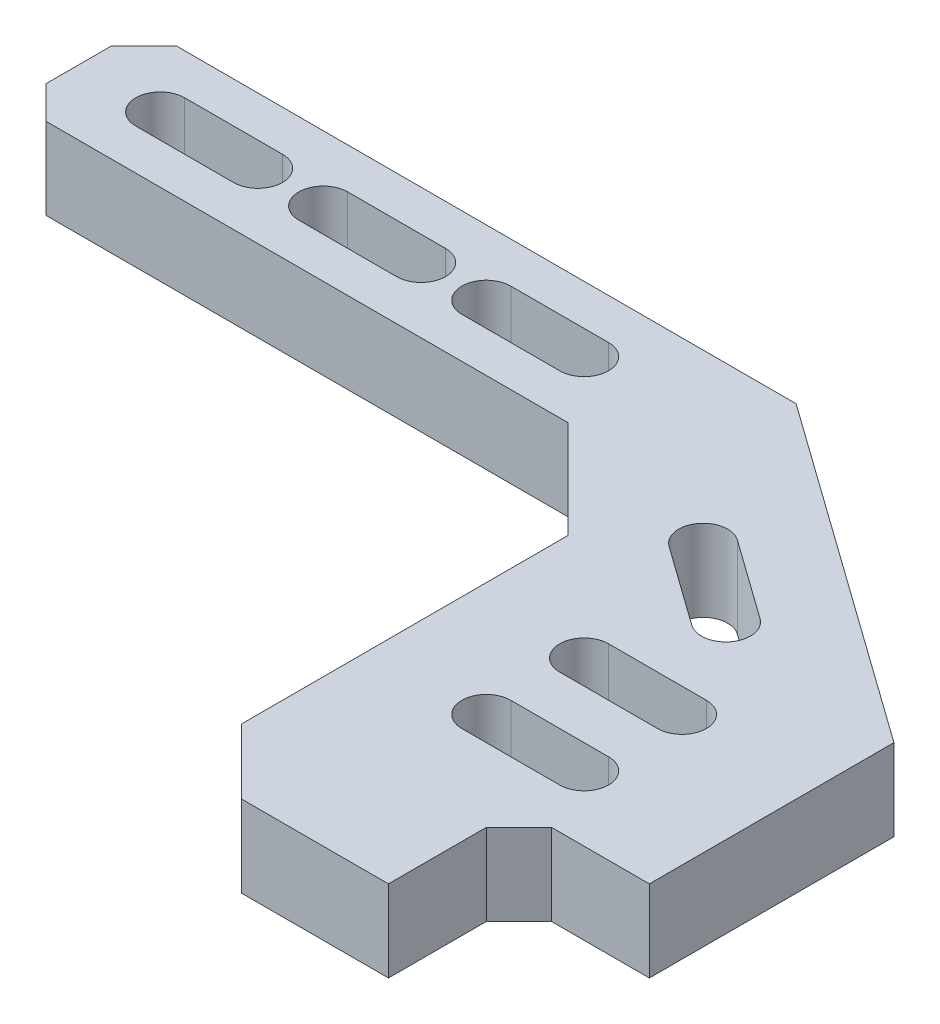
from build123d import *

# Parameters (mm, degrees)
EXTRUDE_1_DEPTH          = 5
CHAMFER_1_SIZE           = 6
CUT_EXTRUDE_1_DEPTH      = 54.4976635
CUT_EXTRUDE_1_DEPTH_BACK = 54.4976635
SKETCH_3_W               = 8
SKETCH_3_H               = 8
CHAMFER_2_SIZE           = 2
CHAMFER_3_SIZE           = 2
CHAMFER_4_SIZE           = 4


with BuildPart() as part:
    # 草图1 → 凸台-拉伸1 (new body)
    with BuildSketch(Plane(origin=(0, 0, 0), x_dir=(1, 0, 0), z_dir=(0, 1, 0))):
        Polygon((20, 4), (41, -11), (41, -34), (20, -34), (20, -4), (-20, -4), (-20, 4), align=None)
    extrude(amount=EXTRUDE_1_DEPTH)

    # 倒角1
    chamfer_1_edges = [part.edges().sort_by_distance(p)[0] for p in [
        (20, 2.5, 4),
    ]]
    chamfer(chamfer_1_edges, length=CHAMFER_1_SIZE)

    # 草图3 → 切除-拉伸1 (cut, two sides: drawn at the far end of the back side and taken through both)
    with BuildSketch(Plane(origin=(0, 5, 0), x_dir=(1, 0, 0), z_dir=(0, 1, 0)).offset(-CUT_EXTRUDE_1_DEPTH_BACK)):
        with BuildLine():
            Line((-15, 1.5), (-9, 1.5))
            ThreePointArc((-9, 1.5), (-7.5, 0), (-9, -1.5))
            Line((-9, -1.5), (-15, -1.5))
            ThreePointArc((-15, -1.5), (-16.5, 0), (-15, 1.5))
        make_face()
        with BuildLine():
            Line((-5, -1.5), (1, -1.5))
            ThreePointArc((1, -1.5), (2.5, 0), (1, 1.5))
            Line((1, 1.5), (-5, 1.5))
            ThreePointArc((-5, 1.5), (-6.5, 0), (-5, -1.5))
        make_face()
        with BuildLine():
            Line((5, -1.5), (11, -1.5))
            ThreePointArc((11, -1.5), (12.5, 0), (11, 1.5))
            Line((11, 1.5), (5, 1.5))
            ThreePointArc((5, 1.5), (3.5, 0), (5, -1.5))
        make_face()
        with BuildLine():
            Line((28.569343123, -10.964314788), (23.686942296, -7.476885626))
            ThreePointArc((23.686942296, -7.476885626), (23.33819938, -5.384428128), (25.430656877, -5.035685212))
            Line((25.430656877, -5.035685212), (30.313057704, -8.523114374))
            ThreePointArc((30.313057704, -8.523114374), (30.66180062, -10.615571872), (28.569343123, -10.964314788))
        make_face()
        with BuildLine():
            Line((27, -14.5), (33, -14.5))
            ThreePointArc((33, -14.5), (34.5, -16), (33, -17.5))
            Line((33, -17.5), (27, -17.5))
            ThreePointArc((27, -17.5), (25.5, -16), (27, -14.5))
        make_face()
        with Locations((37, -30)):
            Rectangle(SKETCH_3_W, SKETCH_3_H)
        with BuildLine():
            Line((27, -20.5), (33, -20.5))
            ThreePointArc((33, -20.5), (34.5, -22), (33, -23.5))
            Line((33, -23.5), (27, -23.5))
            ThreePointArc((27, -23.5), (25.5, -22), (27, -20.5))
        make_face()
    extrude(amount=CUT_EXTRUDE_1_DEPTH + CUT_EXTRUDE_1_DEPTH_BACK, mode=Mode.SUBTRACT)

    # 倒角2
    chamfer_2_edges = [part.edges().sort_by_distance(p)[0] for p in [
        (33, 2.5, 26),
    ]]
    chamfer(chamfer_2_edges, length=CHAMFER_2_SIZE)

    # 倒角3
    chamfer_3_edges = [part.edges().sort_by_distance(p)[0] for p in [
        (-20, 2.5, 4),
        (-20, 2.5, -4),
    ]]
    chamfer(chamfer_3_edges, length=CHAMFER_3_SIZE)

    # 倒角4
    chamfer_4_edges = [part.edges().sort_by_distance(p)[0] for p in [
        (20, 2.5, 34),
    ]]
    chamfer(chamfer_4_edges, length=CHAMFER_4_SIZE)


solid = part.part
